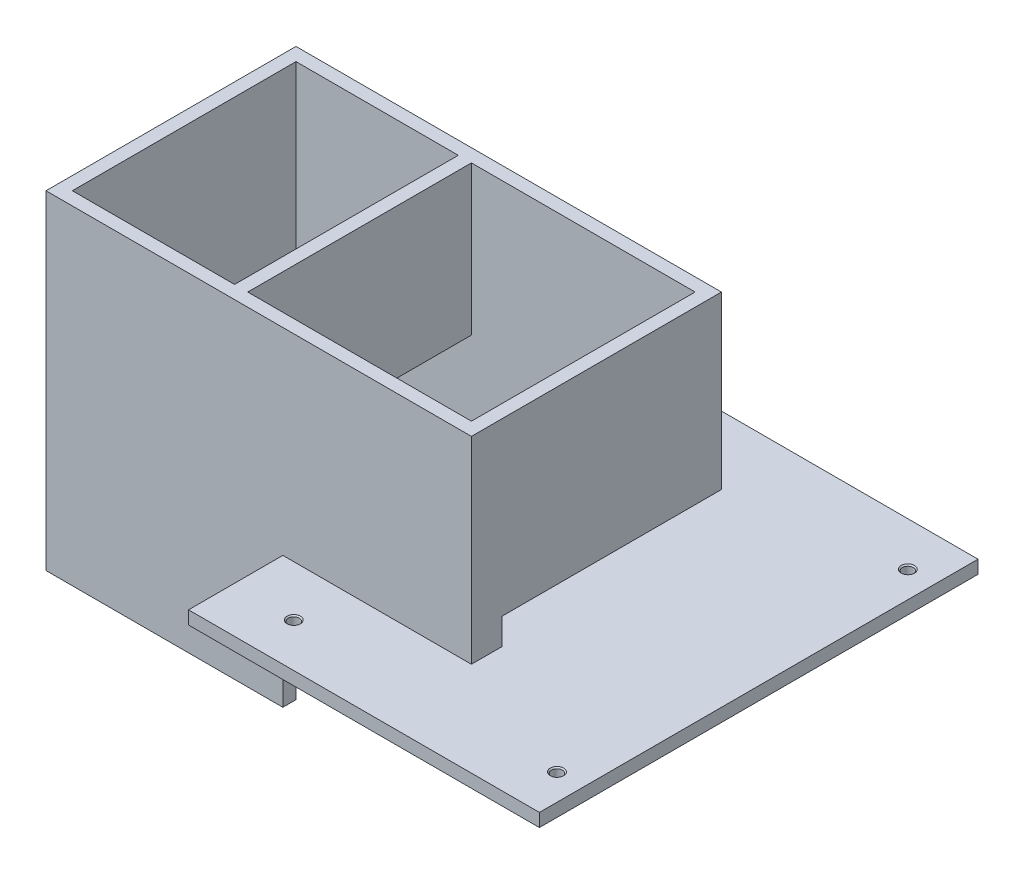
from build123d import *

# Parameters (mm, degrees)
SKETCH_1_W                   = 80
SKETCH_1_H                   = 100
EXTRUDE_1_DEPTH              = 3
SKETCH_2_W                   = 97
SKETCH_2_H                   = 57
SKETCH_2_W_2                 = 91
SKETCH_2_H_2                 = 51
EXTRUDE_2_DEPTH              = 45
SKETCH_3_W                   = 3
SKETCH_3_H                   = 34
EXTRUDE_3_DEPTH              = 51
SKETCH_4_W                   = 30
SKETCH_4_H                   = 6
CUT_EXTRUDE_2_DEPTH          = 50
SKETCH_5_W                   = 57
SKETCH_5_H                   = 57
SKETCH_5_W_2                 = 51
SKETCH_5_H_2                 = 51
EXTRUDE_4_DEPTH              = 30
HOLE_WIZARD_M3_1_D           = 2.5
HOLE_WIZARD_M3_1_CSINK_D     = 3.05
HOLE_WIZARD_M3_1_CSINK_ANGLE = 90
SKETCH_9_W                   = 3
SKETCH_9_H                   = 57
CUT_EXTRUDE_3_DEPTH          = 27


with BuildPart() as part:
    # 草图1 → 凸台-拉伸1 (new body)
    with BuildSketch(Plane(origin=(0, 0, 0), x_dir=(1, 0, 0), z_dir=(0, 1, 0))):
        with Locations((-20.765734509, -21.662442769)):
            Rectangle(SKETCH_1_W, SKETCH_1_H)
    extrude(amount=EXTRUDE_1_DEPTH)

    # 草图2 → 凸台-拉伸2 (add)
    with BuildSketch(Plane(origin=(0, 3, 0), x_dir=(1, 0, 0), z_dir=(0, 1, 0))):
        with Locations((-66.265734509, -21.662442769)):
            Rectangle(SKETCH_2_W, SKETCH_2_H)
        with Locations((-66.265734509, -21.662442769)):
            Rectangle(SKETCH_2_W_2, SKETCH_2_H_2, mode=Mode.SUBTRACT)
    extrude(amount=EXTRUDE_2_DEPTH)

    # 草图3 → 凸台-拉伸3 (add)
    with BuildSketch(Plane.XY.offset(-3.837557231)):
        with Locations((-73.265734509, 31)):
            Rectangle(SKETCH_3_W, SKETCH_3_H)
    extrude(amount=EXTRUDE_3_DEPTH)

    # 草图4 → 切除-拉伸2 (cut)
    with BuildSketch(Plane(origin=(0, 0, -6.837557231), x_dir=(-1, 0, 0), z_dir=(0, 0, -1))):
        with Locations((32.765734509, 6)):
            Rectangle(SKETCH_4_W, SKETCH_4_H)
    extrude(amount=-CUT_EXTRUDE_2_DEPTH, mode=Mode.SUBTRACT)

    # 草图5 → 凸台-拉伸4 (add)
    with BuildSketch(Plane.XZ.offset(-3)):
        with Locations((-86.265734509, 21.662442769)):
            Rectangle(SKETCH_5_W, SKETCH_5_H)
        with Locations((-86.265734509, 21.662442769)):
            Rectangle(SKETCH_5_W_2, SKETCH_5_H_2, mode=Mode.SUBTRACT)
    extrude(amount=EXTRUDE_4_DEPTH)

    # M3 螺纹孔1 (through all)
    with Locations(Plane(origin=(0, 3, 0), x_dir=(1, 0, 0), z_dir=(0, 1, 0))):
        with Locations((-46.765734509, 18.337557231), (13.234265491, 18.337557231), (13.234265491, -61.662442769), (-46.765734509, -61.662442769)):
            CounterSinkHole(HOLE_WIZARD_M3_1_D / 2, HOLE_WIZARD_M3_1_CSINK_D / 2, counter_sink_angle=HOLE_WIZARD_M3_1_CSINK_ANGLE)

    # 草图9 → 切除-拉伸3 (cut)
    with BuildSketch(Plane(origin=(0, -27, 0), x_dir=(-1, 0, 0), z_dir=(0, -1, 0))):
        with Locations((59.265734509, -21.662442769)):
            Rectangle(SKETCH_9_W, SKETCH_9_H)
    extrude(amount=-CUT_EXTRUDE_3_DEPTH, mode=Mode.SUBTRACT)


solid = part.part
